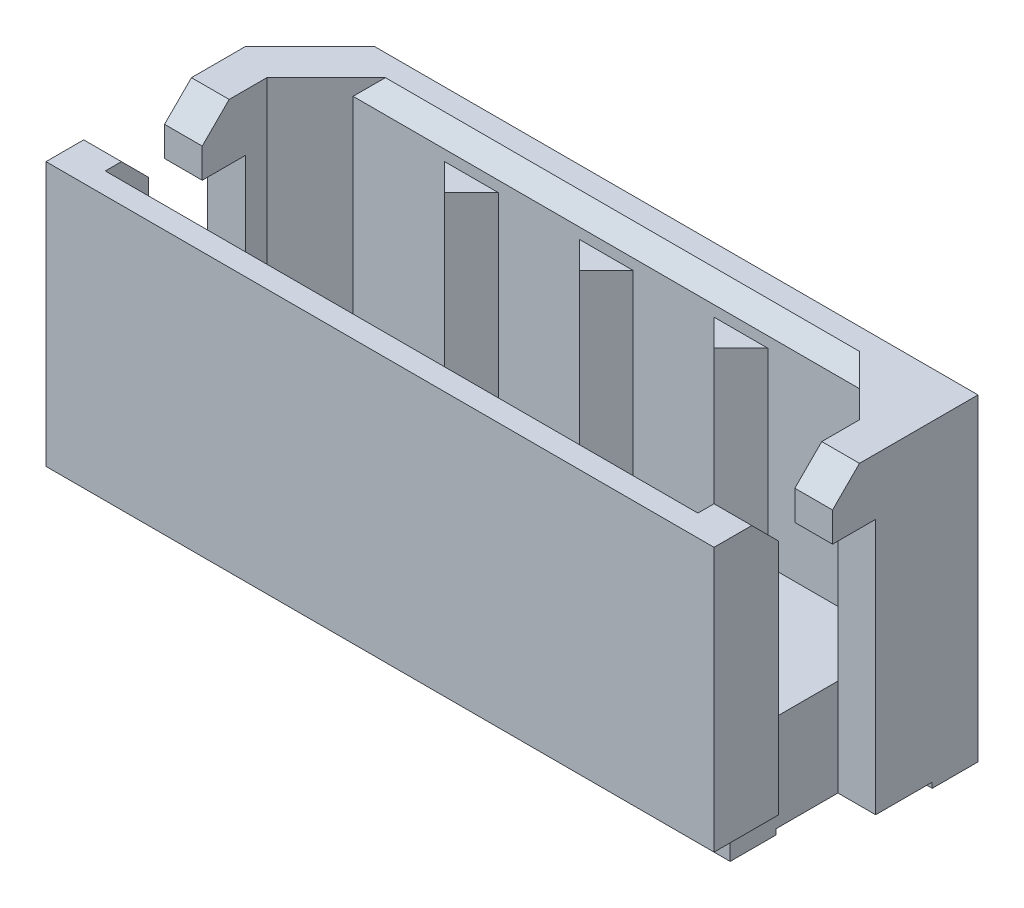
from build123d import *

# Parameters (mm, degrees)
SKETCH_1_W             = 12.4
SKETCH_1_H             = 5.9
EXTRUDE_1_DEPTH        = 4.9
CUT_EXTRUDE_1_DEPTH    = 4
SKETCH_4_W             = 1
SKETCH_4_H             = 1
SKETCH_4_W_2           = 2.2
SKETCH_4_H_2           = 0.1
CUT_EXTRUDE_2_DEPTH    = 15.580123456
SKETCH_5_W             = 0.7
SKETCH_5_H             = 1
CUT_EXTRUDE_3_DEPTH    = 2
CHAMFER_1_SIZE         = 1.2
SKETCH_6_R             = 0.35
CUT_EXTRUDE_4_DEPTH    = 15.539944979
PATTERN_LINEAR_1_COUNT = 4
PATTERN_LINEAR_1_PITCH = 2.5
CUT_EXTRUDE_5_REACH    = 16.205
SKETCH_7_W             = 0.7
SKETCH_7_H             = 1.8
EXTRUDE_2_DEPTH        = 3.5
PATTERN_LINEAR_2_COUNT = 3
PATTERN_LINEAR_2_PITCH = 2.5
CHAMFER_2_SIZE         = 0.3


with BuildPart() as part:
    # 스케치1 → 보스-돌출1 (new body)
    with BuildSketch(Plane.XY):
        with Locations((6.2, 2.95)):
            Rectangle(SKETCH_1_W, SKETCH_1_H)
    extrude(amount=EXTRUDE_1_DEPTH)

    # 스케치2 → 컷-돌출1 (cut)
    with BuildSketch(Plane(origin=(0, 5.9, 0), x_dir=(1, 0, 0), z_dir=(0, 1, 0))):
        Polygon((0.7, -1.5), (1.5, -0.7), (10.9, -0.7), (11.7, -1.5), (11.7, -4.2), (0.7, -4.2), align=None)
    extrude(amount=-CUT_EXTRUDE_1_DEPTH, mode=Mode.SUBTRACT)

    # 스케치4 → 컷-돌출2 (cut, through all)
    with BuildSketch(Plane(origin=(12.4, 0, 0), x_dir=(0, 0, -1), z_dir=(1, 0, 0))):
        with Locations((-4.4, 0.5)):
            Rectangle(SKETCH_4_W, SKETCH_4_H)
        with Locations((-1.95, 0.05)):
            Rectangle(SKETCH_4_W_2, SKETCH_4_H_2)
        Polygon((-3.7, 5.4), (-4.2, 5.9), (-2.2, 5.9), (-2.7, 5.4), (-2.7, 4.85), (-1.9, 4.85), (-1.9, 1.9), (-3.7, 1.9), align=None)
    extrude(amount=-CUT_EXTRUDE_2_DEPTH, mode=Mode.SUBTRACT)

    # 스케치5 → 컷-돌출3 (cut)
    with BuildSketch(Plane.XY.offset(3.9)):
        with Locations((0.35, 0.5)):
            Rectangle(SKETCH_5_W, SKETCH_5_H)
        with Locations((12.05, 0.5)):
            Rectangle(SKETCH_5_W, SKETCH_5_H)
    extrude(amount=-CUT_EXTRUDE_3_DEPTH, mode=Mode.SUBTRACT)

    # 모따기1
    chamfer_1_edges = [part.edges().sort_by_distance(p)[0] for p in [
        (0, 2.95, 0),
    ]]
    chamfer(chamfer_1_edges, length=CHAMFER_1_SIZE)

    # 스케치6 → 컷-돌출4 (cut, through all)
    with BuildSketch(Plane.XZ.offset(-0.1)):
        with Locations(Location((2.45, 1.82, 0), (0, 0, 270))):
            Circle(SKETCH_6_R)
    cut_extrude_4 = extrude(amount=-CUT_EXTRUDE_4_DEPTH, mode=Mode.SUBTRACT)

    # 선형 패턴1: 컷-돌출4 ×4
    with Locations(*[(i * PATTERN_LINEAR_1_PITCH, 0, 0) for i in range(1, PATTERN_LINEAR_1_COUNT)]):
        add(cut_extrude_4, mode=Mode.SUBTRACT)

    # 스케치7 → 컷-돌출5 (cut, up to next)
    with BuildSketch(Plane.XZ.offset(-1), mode=Mode.PRIVATE) as cut_extrude_5_sk1:
        with Locations((0.35, 2.8)):
            Rectangle(SKETCH_7_W, SKETCH_7_H)
    cut_extrude_5_tool1 = extrude(cut_extrude_5_sk1.sketch, amount=-CUT_EXTRUDE_5_REACH, mode=Mode.PRIVATE) & part.part
    # 스케치7 → 컷-돌출5 (cut, up to next)
    with BuildSketch(Plane.XZ.offset(-1), mode=Mode.PRIVATE) as cut_extrude_5_sk2:
        with Locations((12.05, 2.8)):
            Rectangle(SKETCH_7_W, SKETCH_7_H)
    cut_extrude_5_tool2 = extrude(cut_extrude_5_sk2.sketch, amount=-CUT_EXTRUDE_5_REACH, mode=Mode.PRIVATE) & part.part
    add(cut_extrude_5_tool1.solids().sort_by_distance((0.35, 1, 2.8))[0], mode=Mode.SUBTRACT)
    add(cut_extrude_5_tool2.solids().sort_by_distance((12.05, 1, 2.8))[0], mode=Mode.SUBTRACT)

    # 스케치8 → 보스-돌출2 (add)
    with BuildSketch(Plane(origin=(0, 1.9, 0), x_dir=(1, 0, 0), z_dir=(0, 1, 0))):
        Polygon((3.2, -0.7), (4.2, -0.7), (3.7, -1.2), align=None)
    extrude_2 = extrude(amount=EXTRUDE_2_DEPTH)

    # 선형 패턴2: 보스-돌출2 ×3
    with Locations(*[(i * PATTERN_LINEAR_2_PITCH, 0, 0) for i in range(1, PATTERN_LINEAR_2_COUNT)]):
        add(extrude_2)

    # 모따기2
    chamfer_2_edges = [part.edges().sort_by_distance(p)[0] for p in [
        (6.2, 5.9, 0.7),
        (6.2, 5.9, 4.2),
    ]]
    chamfer(chamfer_2_edges, length=CHAMFER_2_SIZE)


solid = part.part
